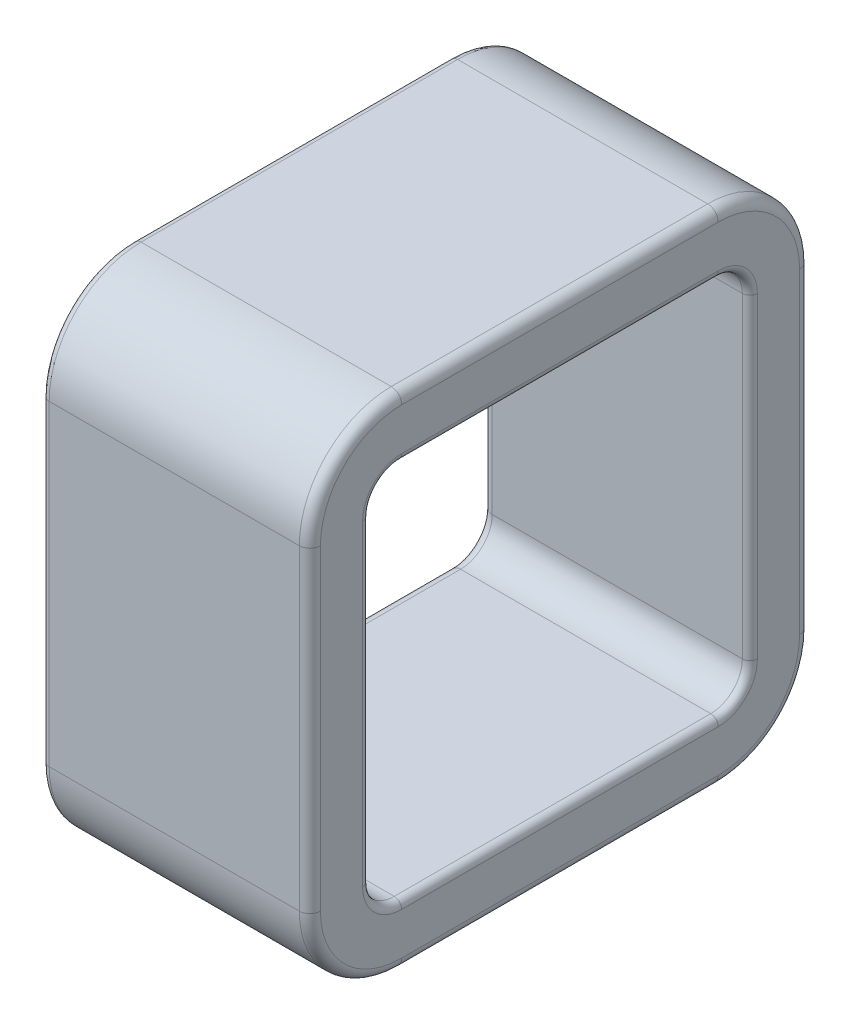
from build123d import *

# Parameters (mm, degrees)
BOSS_EXTRUDE1_DEPTH      = 12
BOSS_EXTRUDE1_DEPTH_BACK = 5.8
FILLET2_R                = 0.7
FILLET3_R                = 0.5


with BuildPart() as part:
    # Sketch1 → Boss-Extrude1 (new, two sides: drawn at the far end of the back side and taken through both)
    with BuildSketch(Plane(origin=(72.6, 0, 0), x_dir=(0, 0, -1), z_dir=(1, 0, 0)).offset(-BOSS_EXTRUDE1_DEPTH_BACK)):
        with BuildLine():
            Line((-31.6, 17.5), (-31.6, -3.5))
            ThreePointArc((-31.6, -3.5), (-29.813351365, -7.813351365), (-25.5, -9.6))
            Line((-25.5, -9.6), (-4.5, -9.6))
            ThreePointArc((-4.5, -9.6), (-0.186648635, -7.813351365), (1.6, -3.5))
            Line((1.6, -3.5), (1.6, 17.5))
            ThreePointArc((1.6, 17.5), (-0.186648635, 21.813351365), (-4.5, 23.6))
            Line((-4.5, 23.6), (-25.5, 23.6))
            ThreePointArc((-25.5, 23.6), (-29.813351365, 21.813351365), (-31.6, 17.5))
        make_face()
        with BuildLine():
            Line((-27.6, 17.5), (-27.6, -3.5))
            ThreePointArc((-27.6, -3.5), (-26.98492424, -4.98492424), (-25.5, -5.6))
            Line((-25.5, -5.6), (-4.5, -5.6))
            ThreePointArc((-4.5, -5.6), (-3.01507576, -4.98492424), (-2.4, -3.5))
            Line((-2.4, -3.5), (-2.4, 17.5))
            ThreePointArc((-2.4, 17.5), (-3.01507576, 18.98492424), (-4.5, 19.6))
            Line((-4.5, 19.6), (-25.5, 19.6))
            ThreePointArc((-25.5, 19.6), (-26.98492424, 18.98492424), (-27.6, 17.5))
        make_face(mode=Mode.SUBTRACT)
    extrude(amount=BOSS_EXTRUDE1_DEPTH + BOSS_EXTRUDE1_DEPTH_BACK)

    # Fillet2
    fillet2_edges = [part.edges().sort_by_distance(p)[0] for p in [
        (66.8, 18.98492424, 26.98492424),
        (66.8, 7, 27.6),
        (66.8, -4.98492424, 26.98492424),
        (66.8, -5.6, 15),
        (84.6, 23.6, 15),
        (66.8, -4.98492424, 3.01507576),
        (66.8, 18.98492424, 3.01507576),
        (84.6, 21.813351365, 29.813351365),
        (66.8, 7, 2.4),
        (66.8, 19.6, 15),
        (84.6, 7, 31.6),
        (84.6, -7.813351365, 29.813351365),
        (84.6, -9.6, 15),
        (84.6, -7.813351365, 0.186648635),
        (84.6, 7, -1.6),
        (84.6, 21.813351365, 0.186648635),
    ]]
    fillet(fillet2_edges, radius=FILLET2_R)

    # Fillet3
    fillet3_edges = [part.edges().sort_by_distance(p)[0] for p in [
        (84.6, 19.6, 15),
        (84.6, 18.98492424, 3.01507576),
        (84.6, 7, 2.4),
        (84.6, -4.98492424, 3.01507576),
        (84.6, -5.6, 15),
        (84.6, -4.98492424, 26.98492424),
        (84.6, 7, 27.6),
        (66.8, 23.6, 15),
        (66.8, 7, -1.6),
        (66.8, 21.813351365, 0.186648635),
        (66.8, -7.813351365, 0.186648635),
        (66.8, -9.6, 15),
        (66.8, -7.813351365, 29.813351365),
        (66.8, 7, 31.6),
        (66.8, 21.813351365, 29.813351365),
        (84.6, 18.98492424, 26.98492424),
    ]]
    fillet(fillet3_edges, radius=FILLET3_R)


solid = part.part
